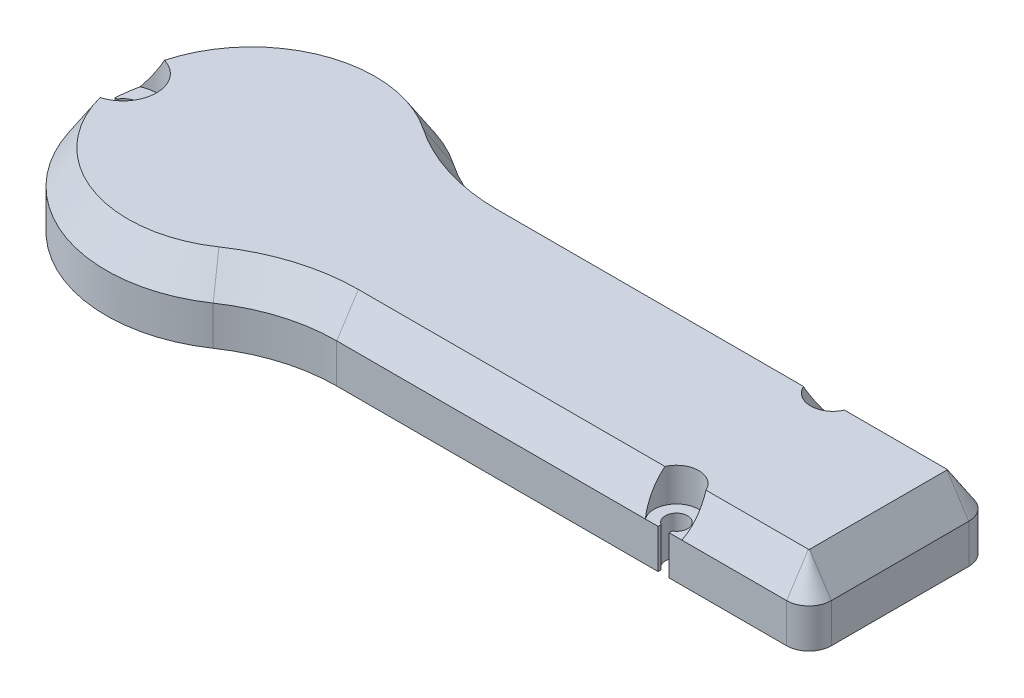
from build123d import *
from OCP.BRepFilletAPI import BRepFilletAPI_MakeChamfer

# Parameters (mm, degrees)
BOSS_EXTRUDE1_DEPTH = 6.5
SKETCH3_R           = 8
CUT_EXTRUDE2_DEPTH  = 5.5
CHAMFER4_SIZE       = 1
FILLET3_R           = 2
FILLET4_R           = 15
CHAMFER7_SIZE       = 3
CHAMFER7_SIZE2      = 1.94822278
SKETCH4_R           = 2
SKETCH4_R_2         = 3
CUT_EXTRUDE7_DEPTH  = 3


with BuildPart() as part:
    # Sketch1 → Boss-Extrude1 (new body)
    with BuildSketch(Plane(origin=(0, 0, 0), x_dir=(1, 0, 0), z_dir=(0, 1, 0))):
        with BuildLine():
            Line((10.132076539, 8.145), (44.5, 8.145))
            Line((44.5, 8.145), (44.5, 7.866025404))
            ThreePointArc((44.5, 7.866025404), (45, 6), (45.5, 7.866025404))
            Line((45.5, 7.866025404), (45.5, 8.145))
            Line((45.5, 8.145), (58, 8.145))
            Line((58, 8.145), (58, -8.145))
            Line((58, -8.145), (45.5, -8.145))
            Line((45.5, -8.145), (45.5, -7.866025404))
            ThreePointArc((45.5, -7.866025404), (45, -6), (44.5, -7.866025404))
            Line((44.5, -7.866025404), (44.5, -8.145))
            Line((44.5, -8.145), (10.132076539, -8.145))
            ThreePointArc((10.132076539, -8.145), (-3.961921331, -12.381566111), (-12.978347352, -0.75))
            Line((-12.978347352, -0.75), (-12.799038106, -0.75))
            ThreePointArc((-12.799038106, -0.75), (-10, 0), (-12.799038106, 0.75))
            Line((-12.799038106, 0.75), (-12.978347352, 0.75))
            ThreePointArc((-12.978347352, 0.75), (-3.961921331, 12.381566111), (10.132076539, 8.145))
        make_face()
    extrude(amount=BOSS_EXTRUDE1_DEPTH)

    # Sketch3 → Cut-Extrude2 (cut)
    with BuildSketch(Plane.XZ):
        with Locations(Location((0, 0, 0), (0, 0, 270))):
            Circle(SKETCH3_R)
    extrude(amount=-CUT_EXTRUDE2_DEPTH, mode=Mode.SUBTRACT)

    # Chamfer4
    chamfer4_edges = [part.edges().sort_by_distance(p)[0] for p in [
        (0, 5.5, 8),
        (0, 0, 8),
    ]]
    chamfer(chamfer4_edges, length=CHAMFER4_SIZE)

    # Fillet3
    fillet3_edges = [part.edges().sort_by_distance(p)[0] for p in [
        (58, 3.25, -8.145),
        (58, 3.25, 8.145),
    ]]
    fillet(fillet3_edges, radius=FILLET3_R)

    # Fillet4
    fillet4_edges = [part.edges().sort_by_distance(p)[0] for p in [
        (10.132076539, 3.25, -8.145),
        (10.132076539, 3.25, 8.145),
    ]]
    fillet(fillet4_edges, radius=FILLET4_R)

    # Chamfer7: one chamfer whose edges measure the first distance from different faces: ONE call of the kernel's chamfer builder (chamfer() names one face for all edges)
    chamfer7_edges_1 = [part.edges().sort_by_distance(p)[0] for p in [
        (-5.74409604, 6.5, -11.662133625),
    ]]
    chamfer7_side_1 = [part.faces().sort_by_distance(p)[0] for p in [
        (-5.74409604, 3.25, -11.662133625),
    ]]
    chamfer7_edges_2 = [part.edges().sort_by_distance(p)[0] for p in [
        (11.341184071, 6.5, -8.80996238),
    ]]
    chamfer7_side_2 = [part.faces().sort_by_distance(p)[0] for p in [
        (11.341184071, 3.25, -8.80996238),
    ]]
    chamfer7_edges_3 = [part.edges().sort_by_distance(p)[0] for p in [
        (30.12891133, 6.5, -8.145),
    ]]
    chamfer7_side_3 = [part.faces().sort_by_distance(p)[0] for p in [
        (30.12891133, 3.25, -8.145),
    ]]
    chamfer7_edges_4 = [part.edges().sort_by_distance(p)[0] for p in [
        (50.75, 6.5, -8.145),
    ]]
    chamfer7_side_4 = [part.faces().sort_by_distance(p)[0] for p in [
        (50.75, 3.25, -8.145),
    ]]
    chamfer7_edges_5 = [part.edges().sort_by_distance(p)[0] for p in [
        (57.414213562, 6.5, -7.559213562),
    ]]
    chamfer7_side_5 = [part.faces().sort_by_distance(p)[0] for p in [
        (57.414213562, 3.25, -7.559213562),
    ]]
    chamfer7_edges_6 = [part.edges().sort_by_distance(p)[0] for p in [
        (58, 6.5, 0),
    ]]
    chamfer7_side_6 = [part.faces().sort_by_distance(p)[0] for p in [
        (58, 3.25, 0),
    ]]
    chamfer7_edges_7 = [part.edges().sort_by_distance(p)[0] for p in [
        (57.414213562, 6.5, 7.559213562),
    ]]
    chamfer7_side_7 = [part.faces().sort_by_distance(p)[0] for p in [
        (57.414213562, 3.25, 7.559213562),
    ]]
    chamfer7_edges_8 = [part.edges().sort_by_distance(p)[0] for p in [
        (50.75, 6.5, 8.145),
    ]]
    chamfer7_side_8 = [part.faces().sort_by_distance(p)[0] for p in [
        (50.75, 3.25, 8.145),
    ]]
    chamfer7_edges_9 = [part.edges().sort_by_distance(p)[0] for p in [
        (30.12891133, 6.5, 8.145),
    ]]
    chamfer7_side_9 = [part.faces().sort_by_distance(p)[0] for p in [
        (30.12891133, 3.25, 8.145),
    ]]
    chamfer7_edges_10 = [part.edges().sort_by_distance(p)[0] for p in [
        (11.341184071, 6.5, 8.80996238),
    ]]
    chamfer7_side_10 = [part.faces().sort_by_distance(p)[0] for p in [
        (11.341184071, 3.25, 8.80996238),
    ]]
    chamfer7_edges_11 = [part.edges().sort_by_distance(p)[0] for p in [
        (-5.74409604, 6.5, 11.662133625),
    ]]
    chamfer7_side_11 = [part.faces().sort_by_distance(p)[0] for p in [
        (-5.74409604, 3.25, 11.662133625),
    ]]
    chamfer7 = BRepFilletAPI_MakeChamfer(part.part.solid().wrapped)
    for e in chamfer7_edges_1:
        chamfer7.Add(CHAMFER7_SIZE, CHAMFER7_SIZE2, e.wrapped, chamfer7_side_1[0].wrapped)  # the first distance lies on this face
    for e in chamfer7_edges_2:
        chamfer7.Add(CHAMFER7_SIZE, CHAMFER7_SIZE2, e.wrapped, chamfer7_side_2[0].wrapped)  # the first distance lies on this face
    for e in chamfer7_edges_3:
        chamfer7.Add(CHAMFER7_SIZE, CHAMFER7_SIZE2, e.wrapped, chamfer7_side_3[0].wrapped)  # the first distance lies on this face
    for e in chamfer7_edges_4:
        chamfer7.Add(CHAMFER7_SIZE, CHAMFER7_SIZE2, e.wrapped, chamfer7_side_4[0].wrapped)  # the first distance lies on this face
    for e in chamfer7_edges_5:
        chamfer7.Add(CHAMFER7_SIZE, CHAMFER7_SIZE2, e.wrapped, chamfer7_side_5[0].wrapped)  # the first distance lies on this face
    for e in chamfer7_edges_6:
        chamfer7.Add(CHAMFER7_SIZE, CHAMFER7_SIZE2, e.wrapped, chamfer7_side_6[0].wrapped)  # the first distance lies on this face
    for e in chamfer7_edges_7:
        chamfer7.Add(CHAMFER7_SIZE, CHAMFER7_SIZE2, e.wrapped, chamfer7_side_7[0].wrapped)  # the first distance lies on this face
    for e in chamfer7_edges_8:
        chamfer7.Add(CHAMFER7_SIZE, CHAMFER7_SIZE2, e.wrapped, chamfer7_side_8[0].wrapped)  # the first distance lies on this face
    for e in chamfer7_edges_9:
        chamfer7.Add(CHAMFER7_SIZE, CHAMFER7_SIZE2, e.wrapped, chamfer7_side_9[0].wrapped)  # the first distance lies on this face
    for e in chamfer7_edges_10:
        chamfer7.Add(CHAMFER7_SIZE, CHAMFER7_SIZE2, e.wrapped, chamfer7_side_10[0].wrapped)  # the first distance lies on this face
    for e in chamfer7_edges_11:
        chamfer7.Add(CHAMFER7_SIZE, CHAMFER7_SIZE2, e.wrapped, chamfer7_side_11[0].wrapped)  # the first distance lies on this face
    add(Compound.cast(chamfer7.Shape()), mode=Mode.REPLACE)

    # Sketch4 → Cut-Extrude7 (cut)
    with BuildSketch(Plane(origin=(0, 6.5, 0), x_dir=(1, 0, 0), z_dir=(0, 1, 0))):
        with Locations((45, 7)):
            Circle(SKETCH4_R)
        with Locations((45, -7)):
            Circle(SKETCH4_R)
        with Locations((-11.5, 0)):
            Circle(SKETCH4_R_2)
    extrude(amount=-CUT_EXTRUDE7_DEPTH, mode=Mode.SUBTRACT)


solid = part.part
